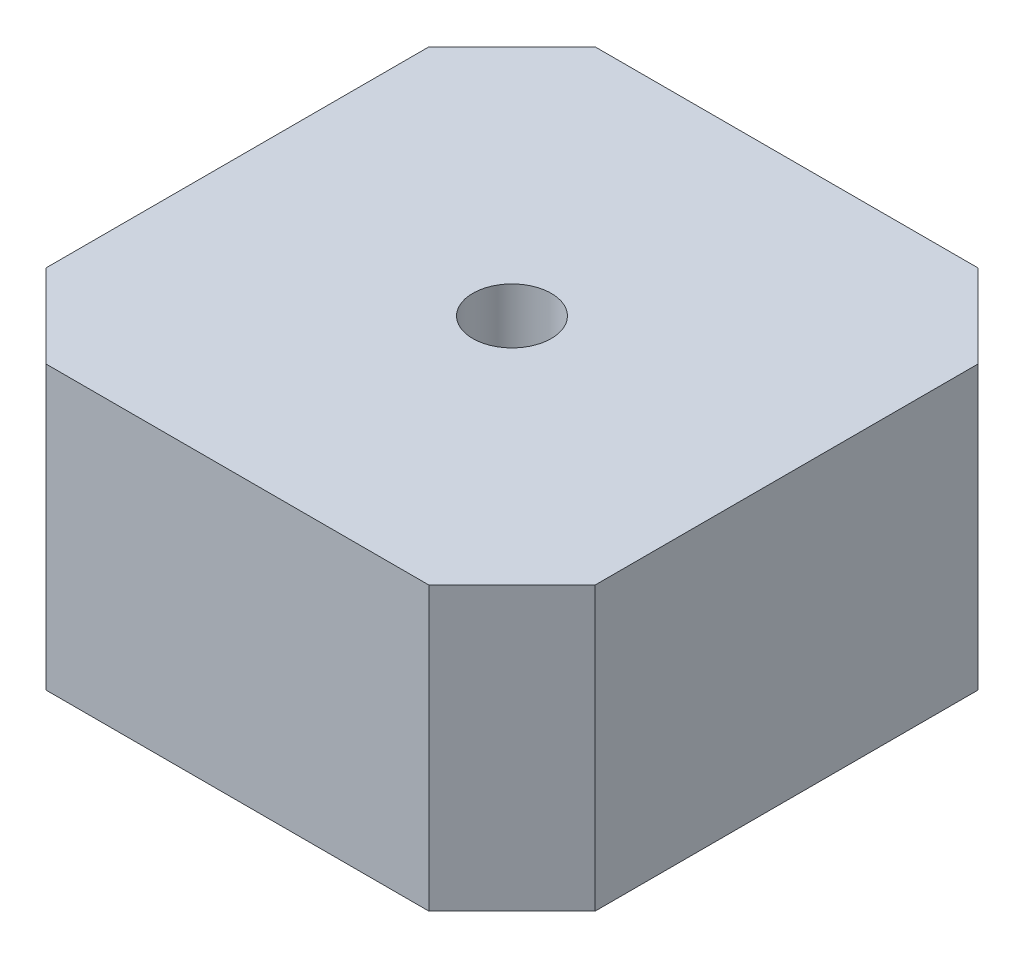
from build123d import *

# Parameters (mm, degrees)
CROQUIS1_W              = 35
CROQUIS1_H              = 35
SALIENTE_EXTRUIR1_DEPTH = 18
CROQUIS2_OUTSIDE_W      = 47.534
CROQUIS2_OUTSIDE_H      = 47.534
CORTAR_EXTRUIR2_DEPTH   = 18
CROQUIS3_R              = 2.5
CORTAR_EXTRUIR3_DEPTH   = 53.668776329


with BuildPart() as part:
    # Croquis1 → Saliente-Extruir1 (new body)
    with BuildSketch(Plane(origin=(0, 0, 0), x_dir=(1, 0, 0), z_dir=(0, 1, 0))):
        with Locations((17.5, 17.5)):
            Rectangle(CROQUIS1_W, CROQUIS1_H)
    extrude(amount=SALIENTE_EXTRUIR1_DEPTH)

    # Croquis2 outside → Cortar-Extruir2 (cut)
    with BuildSketch(Plane(origin=(0, 18, 0), x_dir=(1, 0, 0), z_dir=(0, 1, 0))):
        with Locations((17.5, 17.5)):
            Rectangle(CROQUIS2_OUTSIDE_W, CROQUIS2_OUTSIDE_H)
        Polygon((5.30151519, 35), (0, 29.69848481), (0, 5.30151519), (5.30151519, 0), (29.69848481, 0), (35, 5.30151519), (35, 29.69848481), (29.69848481, 35), align=None, mode=Mode.SUBTRACT)
    extrude(amount=-CORTAR_EXTRUIR2_DEPTH, mode=Mode.SUBTRACT)

    # Croquis3 → Cortar-Extruir3 (cut, through all)
    with BuildSketch(Plane(origin=(0, 18, 0), x_dir=(1, 0, 0), z_dir=(0, 1, 0))):
        with Locations(Location((17.5, 17.5, 0), (0, 0, 270))):
            Circle(CROQUIS3_R)
    extrude(amount=-CORTAR_EXTRUIR3_DEPTH, mode=Mode.SUBTRACT)


solid = part.part
